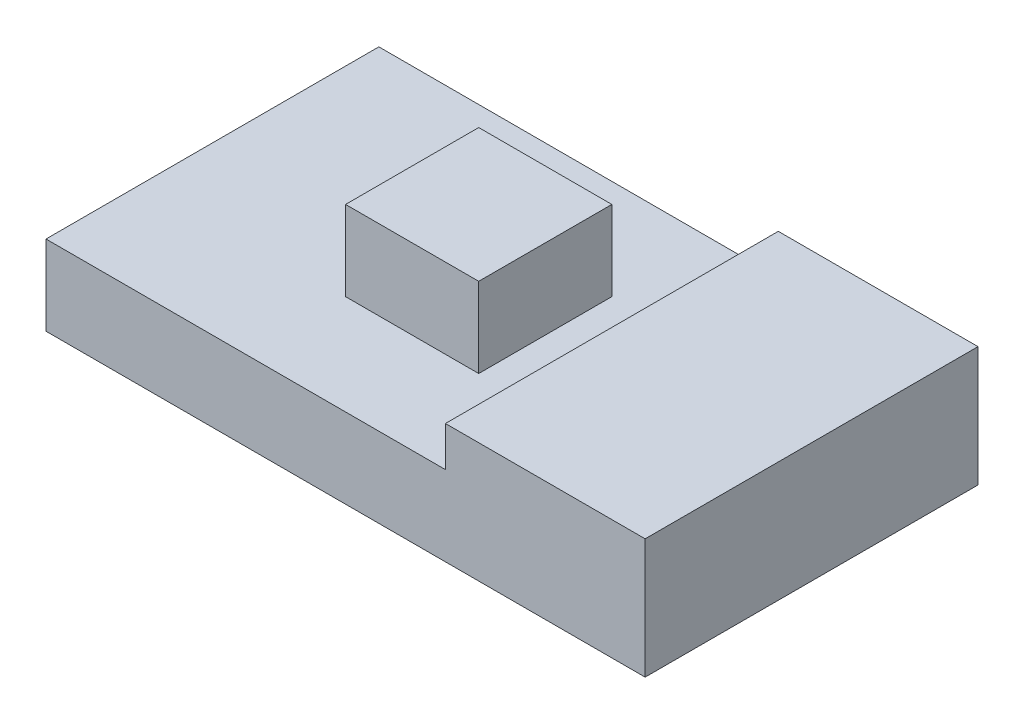
from build123d import *

# Parameters (mm, degrees)
SKETCH6_W           = 30
SKETCH6_H           = 25
BOSS_EXTRUDE6_DEPTH = 6
SKETCH7_W           = 15
SKETCH7_H           = 25
BOSS_EXTRUDE7_DEPTH = 3
SKETCH8_W           = 10
SKETCH8_H           = 10
BOSS_EXTRUDE8_DEPTH = 6
SKETCH9_W           = 25
SKETCH9_H           = 6
BOSS_EXTRUDE9_DEPTH = 15


with BuildPart() as part:
    # Sketch6 → Boss-Extrude6 (new body)
    with BuildSketch(Plane(origin=(0, 0, 0), x_dir=(1, 0, 0), z_dir=(0, 1, 0))):
        with Locations((-0.909090909, 0)):
            Rectangle(SKETCH6_W, SKETCH6_H)
    extrude(amount=BOSS_EXTRUDE6_DEPTH)

    # Sketch7 → Boss-Extrude7 (add)
    with BuildSketch(Plane(origin=(0, 6, 0), x_dir=(1, 0, 0), z_dir=(0, 1, 0))):
        with Locations((6.590909091, 0)):
            Rectangle(SKETCH7_W, SKETCH7_H)
    extrude(amount=BOSS_EXTRUDE7_DEPTH)

    # Sketch8 → Boss-Extrude8 (add)
    with BuildSketch(Plane(origin=(0, 6, 0), x_dir=(1, 0, 0), z_dir=(0, 1, 0))):
        with Locations((-10.909090909, 0)):
            Rectangle(SKETCH8_W, SKETCH8_H)
    extrude(amount=BOSS_EXTRUDE8_DEPTH)

    # Sketch9 → Boss-Extrude9 (add)
    with BuildSketch(Plane.ZY.offset(15.909090909)):
        with Locations((0, 3)):
            Rectangle(SKETCH9_W, SKETCH9_H)
    extrude(amount=BOSS_EXTRUDE9_DEPTH)


solid = part.part
